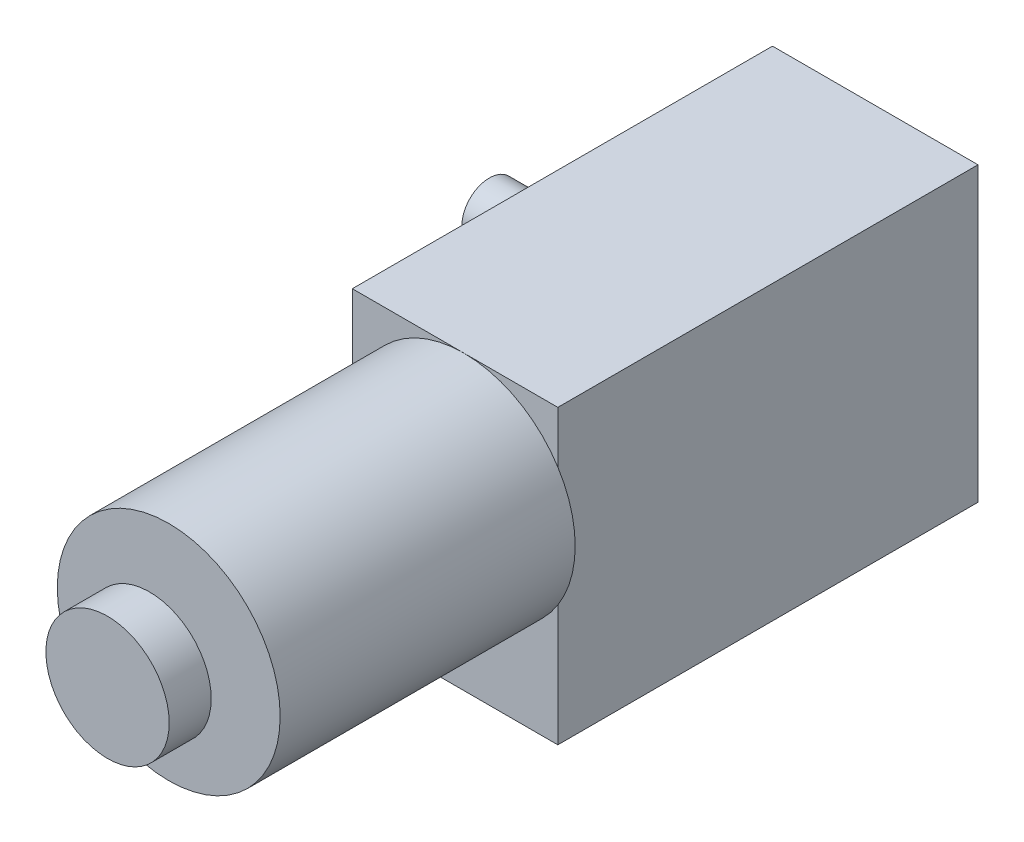
from build123d import *

# Parameters (mm, degrees)
SKETCH1_R      = 12.2
EXTRUDE1_DEPTH = 32.3
SKETCH2_R      = 2.05
EXTRUDE2_DEPTH = 2.1
SKETCH3_R      = 6.75
EXTRUDE3_DEPTH = 4.6
SKETCH4_W      = 22.5
SKETCH4_H      = 32
EXTRUDE4_DEPTH = 46
SKETCH5_R      = 3.7
SKETCH5_R_2    = 1.5
SKETCH5_R_3    = 6.5
EXTRUDE5_DEPTH = 2
SKETCH6_R      = 3
EXTRUDE6_DEPTH = 14
SKETCH7_R      = 1.5
EXTRUDE7_DEPTH = 8


with BuildPart() as part:
    # Sketch1 → Extrude1 (new body)
    with BuildSketch(Plane.XY):
        Circle(SKETCH1_R)
    extrude(amount=EXTRUDE1_DEPTH)

    # Sketch2 → Extrude2 (add)
    with BuildSketch(Plane.XY.offset(32.3)):
        Circle(SKETCH2_R)
    extrude(amount=EXTRUDE2_DEPTH)

    # Sketch3 → Extrude3 (add)
    with BuildSketch(Plane.XY.offset(34.4)):
        Circle(SKETCH3_R)
    extrude(amount=EXTRUDE3_DEPTH)

    # Sketch4 → Extrude4 (add)
    with BuildSketch(Plane(origin=(0, 0, 0), x_dir=(-1, 0, 0), z_dir=(0, 0, -1))):
        with Locations((0.95, -3.8)):
            Rectangle(SKETCH4_W, SKETCH4_H)
    extrude(amount=EXTRUDE4_DEPTH)

    # Sketch5 → Extrude5 (add)
    # profile 1 of 6: a face of its own
    with BuildSketch(Plane.ZY.offset(12.2)):
        with Locations(Location((-40, -12.8, 0), (0, 0, 90))):
            Circle(SKETCH5_R)
        with Locations(Location((-40, -12.8, 0), (0, 0, 270))):
            Circle(SKETCH5_R_2, mode=Mode.SUBTRACT)
    # profile 2 of 6: a face of its own
    with BuildSketch(Plane.ZY.offset(12.2)):
        with Locations(Location((-40, 5.2, 0), (0, 0, 90))):
            Circle(SKETCH5_R)
        with Locations(Location((-40, 5.2, 0), (0, 0, 90))):
            Circle(SKETCH5_R_2, mode=Mode.SUBTRACT)
    # profile 3 of 6: a face of its own
    with BuildSketch(Plane.ZY.offset(12.2)):
        with Locations(Location((-7, 5.2, 0), (0, 0, 90))):
            Circle(SKETCH5_R)
        with Locations(Location((-7, 5.2, 0), (0, 0, 270))):
            Circle(SKETCH5_R_2, mode=Mode.SUBTRACT)
    # profile 4 of 6: a face of its own
    with BuildSketch(Plane.ZY.offset(12.2)):
        with Locations(Location((-7, -12.8, 0), (0, 0, 90))):
            Circle(SKETCH5_R)
        with Locations(Location((-7, -12.8, 0), (0, 0, 90))):
            Circle(SKETCH5_R_2, mode=Mode.SUBTRACT)
    # profile 5 of 6: a face of its own
    with BuildSketch(Plane.ZY.offset(12.2)):
        with Locations(Location((-31, -3.8, 0), (0, 0, 90))):
            Circle(SKETCH5_R_3)
    # profile 6 of 6: a face of its own
    with BuildSketch(Plane.ZY.offset(12.2)):
        with BuildLine():
            Line((-20, -8.8), (-20, 1.2))
            ThreePointArc((-20, 1.2), (-18.5, 2.7), (-17, 1.2))
            Line((-17, 1.2), (-17, -8.8))
            ThreePointArc((-17, -8.8), (-18.5, -10.3), (-20, -8.8))
        make_face()
    extrude(amount=EXTRUDE5_DEPTH)

    # Sketch6 → Extrude6 (add)
    with BuildSketch(Plane.ZY.offset(14.2)):
        with Locations(Location((-31, -3.8, 0), (0, 0, 270))):
            Circle(SKETCH6_R)
    extrude(amount=EXTRUDE6_DEPTH)

    # Sketch7 → Extrude7 (cut)
    with BuildSketch(Plane.ZY.offset(28.2)):
        with Locations(Location((-31, -3.8, 0), (0, 0, 270))):
            Circle(SKETCH7_R)
    extrude(amount=-EXTRUDE7_DEPTH, mode=Mode.SUBTRACT)


solid = part.part
